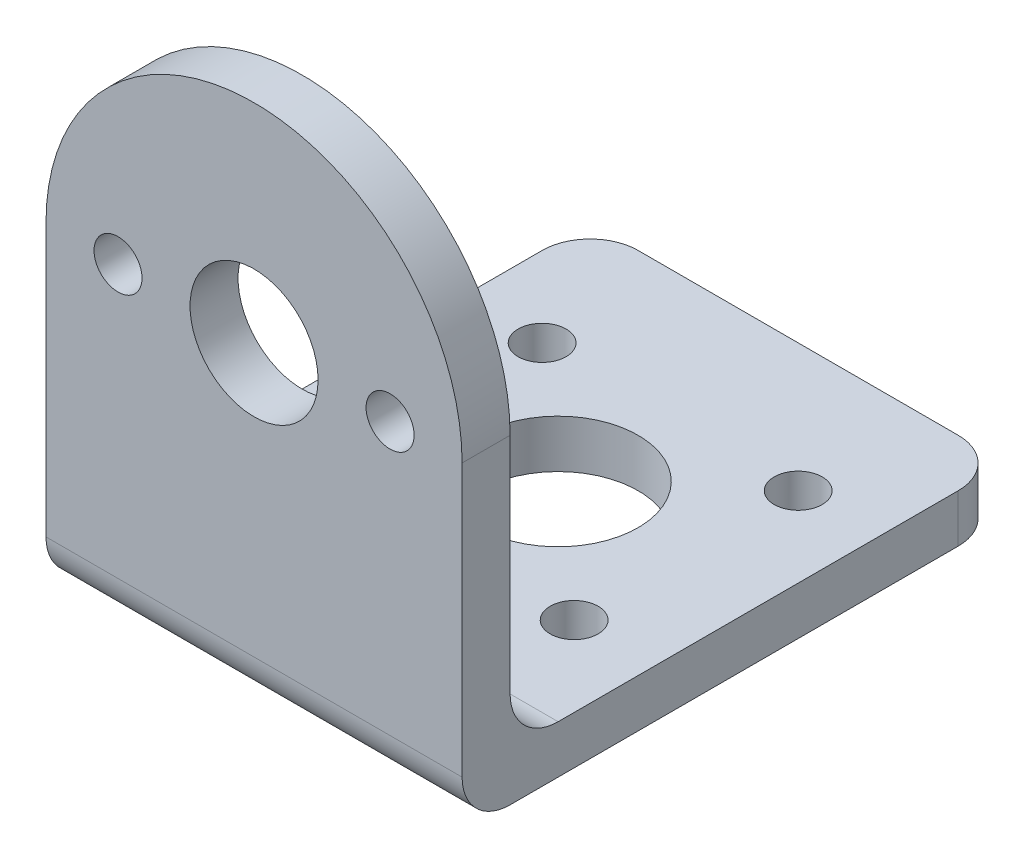
from build123d import *

# Parameters (mm, degrees)
SKETCH_1_R          = 4
SKETCH_1_R_2        = 1.5
EXTRUDE_1_DEPTH     = 3
SKETCH_2_W          = 26
SKETCH_2_H          = 3
EXTRUDE_2_DEPTH     = 31
SKETCH_3_R          = 5
SKETCH_3_R_2        = 1.5
CUT_EXTRUDE_1_DEPTH = 40.115214431
FILLET_1_R          = 3


with BuildPart() as part:
    # 草图1 → 凸台-拉伸1 (new body)
    with BuildSketch(Plane.XY):
        with BuildLine():
            Line((-13, 0), (-13, -20))
            Line((-13, -20), (13, -20))
            Line((13, -20), (13, 0))
            ThreePointArc((13, 0), (0, 13), (-13, 0))
        make_face()
        Circle(SKETCH_1_R, mode=Mode.SUBTRACT)
        with Locations((-8.5, 0)):
            Circle(SKETCH_1_R_2, mode=Mode.SUBTRACT)
        with Locations(Location((8.5, 0, 0), (0, 0, 180))):
            Circle(SKETCH_1_R_2, mode=Mode.SUBTRACT)
    extrude(amount=EXTRUDE_1_DEPTH)

    # 草图2 → 凸台-拉伸2 (add)
    with BuildSketch(Plane.XY):
        with Locations((0, -18.5)):
            Rectangle(SKETCH_2_W, SKETCH_2_H)
    extrude(amount=-EXTRUDE_2_DEPTH)

    # 草图3 → 切除-拉伸1 (cut, through all)
    with BuildSketch(Plane(origin=(0, 0, 0), x_dir=(1, 0, 0), z_dir=(0, 1, 0))):
        with Locations(Location((0, 16, 0), (0, 0, 270))):
            Circle(SKETCH_3_R)
        with Locations(Location((-8, 23, 0), (0, 0, 270))):
            Circle(SKETCH_3_R_2)
        with Locations(Location((8, 23, 0), (0, 0, 270))):
            Circle(SKETCH_3_R_2)
        with Locations(Location((8, 9, 0), (0, 0, 270))):
            Circle(SKETCH_3_R_2)
        with Locations(Location((-8, 9, 0), (0, 0, 270))):
            Circle(SKETCH_3_R_2)
    extrude(amount=-CUT_EXTRUDE_1_DEPTH, mode=Mode.SUBTRACT)

    # 圆角1
    fillet_1_edges = [part.edges().sort_by_distance(p)[0] for p in [
        (0, -20, 3),
        (-13, -18.5, -31),
        (13, -18.5, -31),
        (0, -17, 0),
    ]]
    fillet(fillet_1_edges, radius=FILLET_1_R)


solid = part.part
